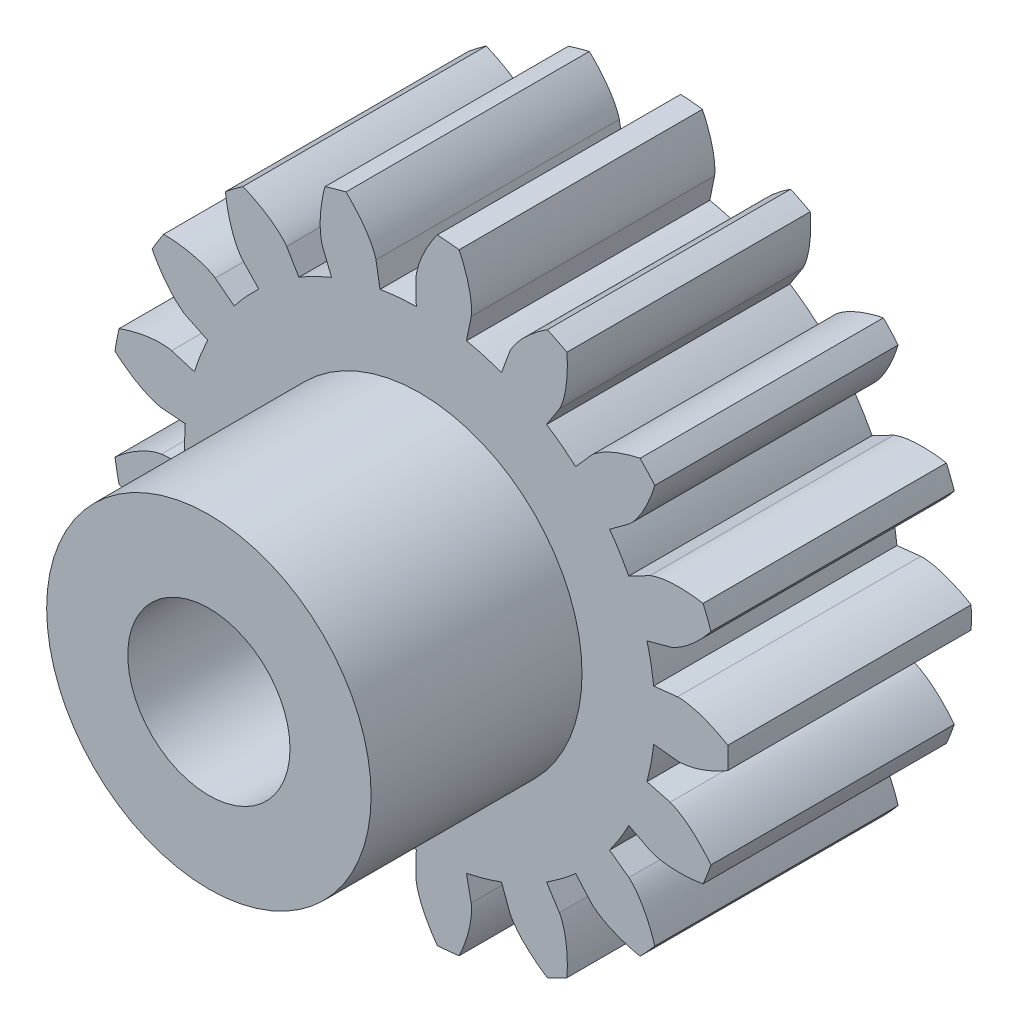
from build123d import *

# Parameters (mm, degrees)
SZKIC1_R                    = 9.5
DODANIE_WYCI_GNI_CIE1_DEPTH = 7.5
SZKIC2_R                    = 5
DODANIE_WYCI_GNI_CIE2_DEPTH = 6.5
SZKIC3_R                    = 2.5
WYTNIJ_WYCI_GNI_CIE1_DEPTH  = 20.403607912
WYTNIJ_WYCI_GNI_CIE3_DEPTH  = 10


with BuildPart() as part:
    # Szkic1 → Dodanie-wyciągnięcie1 (new body)
    with BuildSketch(Plane.XY):
        Circle(SZKIC1_R)
    extrude(amount=DODANIE_WYCI_GNI_CIE1_DEPTH)

    # Szkic2 → Dodanie-wyciągnięcie2 (add)
    with BuildSketch(Plane.XY.offset(7.5)):
        with Locations(Location((0, 0, 0), (0, 0, 180))):
            Circle(SZKIC2_R)
    extrude(amount=DODANIE_WYCI_GNI_CIE2_DEPTH)

    # Szkic3 → Wytnij-wyciągnięcie1 (cut, through all)
    with BuildSketch(Plane.XY.offset(14)):
        Circle(SZKIC3_R)
    extrude(amount=-WYTNIJ_WYCI_GNI_CIE1_DEPTH, mode=Mode.SUBTRACT)

    # Szkic5 → Wytnij-wyciągnięcie3 (cut)
    with BuildSketch(Plane(origin=(0, 0, 0), x_dir=(-1, 0, 0), z_dir=(0, 0, -1))):
        with BuildLine():
            add(Edge.make_bspline(
                [(-6.445103932, 4.717943494), (-6.447753047, 4.719948021), (-6.455084128, 4.725699992), (-6.468549193, 4.737084044), (-6.48993824, 4.75636624), (-6.516319022, 4.781958668), (-6.549384668, 4.816185791), (-6.586982164, 4.857956124), (-6.626847309, 4.905345175), (-6.668616331, 4.95846696), (-6.708843778, 5.01281802), (-6.747606045, 5.068267615), (-6.784971395, 5.124596973), (-6.828734543, 5.194088915), (-6.879111818, 5.279147161), (-6.934878107, 5.380999911), (-6.994400572, 5.499321176), (-7.051006237, 5.622778311), (-7.1033458, 5.746575884), (-7.152299389, 5.874186724), (-7.192770252, 5.987908476), (-7.220727721, 6.074514444), (-7.237000382, 6.126888761), (-7.243163934, 6.147078674)],
                knots=[0, 0, 0, 0, 0, 0.005376749, 0.015083688, 0.02853182, 0.046610139, 0.064854849, 0.092110525, 0.119476176, 0.146842496, 0.174208854, 0.201574956, 0.228941013, 0.256307345, 0.307035032, 0.361767352, 0.416499661, 0.471231937, 0.525964282, 0.580696615, 0.635428982, 0.670002826, 0.670002826, 0.670002826, 0.670002826, 0.670002826], degree=4))
            ThreePointArc((-7.243163934, 6.147078674), (-8.077062789, 5.001105547), (-8.731195161, 3.743825726))
            add(Edge.make_bspline(
                [(-7.096159856, 3.666452073), (-7.099135047, 3.667929969), (-7.107551744, 3.67192861), (-7.123744226, 3.678907732), (-7.150538858, 3.689459608), (-7.185207187, 3.701667189), (-7.230584678, 3.716010001), (-7.284734592, 3.731047259), (-7.344924955, 3.745609956), (-7.411095682, 3.759321634), (-7.477679672, 3.771105415), (-7.544593944, 3.781087963), (-7.611673087, 3.789427897), (-7.693386636, 3.797627837), (-7.791982739, 3.804810001), (-7.908014756, 3.809330259), (-8.040463055, 3.809872258), (-8.176208666, 3.805513991), (-8.31035746, 3.79718512), (-8.446410491, 3.78412553), (-8.566249445, 3.769663414), (-8.656237645, 3.756086312), (-8.71037456, 3.747307759), (-8.731195161, 3.743825726)],
                knots=[0, 0, 0, 0, 0, 0.005376749, 0.015083688, 0.02853182, 0.046610139, 0.064854849, 0.092110525, 0.119476176, 0.146842496, 0.174208854, 0.201574956, 0.228941013, 0.256307345, 0.307035032, 0.361767352, 0.416499661, 0.471231937, 0.525964282, 0.580696615, 0.635428982, 0.670002826, 0.670002826, 0.670002826, 0.670002826, 0.670002826], degree=4))
            Line((-7.096159856, 3.666452073), (-6.441049767, 3.327969035))
            add(Edge.make_bspline(
                [(-6.441049767, 3.327969035), (-6.180635855, 3.830846497), (-5.850098648, 4.282387863)],
                knots=[0, 0, 0, 0.49973366, 0.49973366, 0.49973366], degree=2))
            Line((-5.850098648, 4.282387863), (-6.445103932, 4.717943494))
        make_face()
        with BuildLine():
            add(Edge.make_bspline(
                [(-4.305562663, 6.727591371), (-4.307308771, 6.730417508), (-4.312066949, 6.738429352), (-4.320510354, 6.753908808), (-4.333489513, 6.779615535), (-4.348843809, 6.813009601), (-4.367312343, 6.856870132), (-4.387281779, 6.909401589), (-4.40733602, 6.967991515), (-4.427094671, 7.032614815), (-4.44497178, 7.097827499), (-4.461085814, 7.163535253), (-4.475579454, 7.229558736), (-4.491283989, 7.310167115), (-4.507532816, 7.407679938), (-4.522739876, 7.522799906), (-4.53550035, 7.654633194), (-4.5436857, 7.790201869), (-4.547770047, 7.924546898), (-4.547319557, 8.061224539), (-4.543976478, 8.181886676), (-4.538760357, 8.272743739), (-4.535014376, 8.327459698), (-4.533468279, 8.348512763)],
                knots=[0, 0, 0, 0, 0, 0.005376749, 0.015083688, 0.02853182, 0.046610139, 0.064854849, 0.092110525, 0.119476176, 0.146842496, 0.174208854, 0.201574956, 0.228941013, 0.256307345, 0.307035032, 0.361767352, 0.416499661, 0.471231937, 0.525964282, 0.580696615, 0.635428982, 0.670002826, 0.670002826, 0.670002826, 0.670002826, 0.670002826], degree=4))
            ThreePointArc((-4.533468279, 8.348512763), (-5.725029046, 7.581163659), (-6.789171173, 6.645085009))
            add(Edge.make_bspline(
                [(-5.292496745, 5.982293348), (-5.294737151, 5.984746208), (-5.301141011, 5.991515291), (-5.313718901, 6.003872529), (-5.334892375, 6.023391197), (-5.362809741, 6.047298073), (-5.39994177, 6.077064586), (-5.445002977, 6.110647617), (-5.495868167, 6.145970195), (-5.552617303, 6.182659577), (-5.610448231, 6.217700538), (-5.669237819, 6.25118121), (-5.728774525, 6.283189748), (-5.802007981, 6.320354302), (-5.891351612, 6.362668491), (-5.99791534, 6.408799106), (-6.121223908, 6.457150349), (-6.249377308, 6.502123357), (-6.377476068, 6.54281705), (-6.50905941, 6.579787369), (-6.626030225, 6.60959267), (-6.714846337, 6.629439887), (-6.768498686, 6.64081064), (-6.789171173, 6.645085009)],
                knots=[0, 0, 0, 0, 0, 0.005376749, 0.015083688, 0.02853182, 0.046610139, 0.064854849, 0.092110525, 0.119476176, 0.146842496, 0.174208854, 0.201574956, 0.228941013, 0.256307345, 0.307035032, 0.361767352, 0.416499661, 0.471231937, 0.525964282, 0.580696615, 0.635428982, 0.670002826, 0.670002826, 0.670002826, 0.670002826, 0.670002826], degree=4))
            Line((-5.292496745, 5.982293348), (-4.803898957, 5.430014255))
            add(Edge.make_bspline(
                [(-4.803898957, 5.430014255), (-4.379409923, 5.804861168), (-3.908077601, 6.106507141)],
                knots=[0, 0, 0, 0.49973366, 0.49973366, 0.49973366], degree=2))
            Line((-3.908077601, 6.106507141), (-4.305562663, 6.727591371))
        make_face()
        with BuildLine():
            add(Edge.make_bspline(
                [(-1.584531299, 7.828640755), (-1.585138578, 7.831906815), (-1.586681234, 7.84109649), (-1.588962651, 7.858580762), (-1.591779016, 7.887240185), (-1.594033142, 7.923925835), (-1.595410286, 7.971496166), (-1.595054679, 8.027694083), (-1.59258958, 8.089571989), (-1.587669344, 8.15696907), (-1.580781714, 8.224236044), (-1.572071224, 8.29132776), (-1.561735708, 8.358128531), (-1.547260646, 8.438966738), (-1.527186531, 8.535764491), (-1.499780563, 8.648604088), (-1.464055674, 8.776144584), (-1.422715231, 8.905515497), (-1.37799275, 9.032263943), (-1.328199022, 9.159549311), (-1.281493501, 9.270855744), (-1.243808256, 9.353693151), (-1.220549549, 9.403361059), (-1.211502613, 9.422433944)],
                knots=[0, 0, 0, 0, 0, 0.005376749, 0.015083688, 0.02853182, 0.046610139, 0.064854849, 0.092110525, 0.119476176, 0.146842496, 0.174208854, 0.201574956, 0.228941013, 0.256307345, 0.307035032, 0.361767352, 0.416499661, 0.471231937, 0.525964282, 0.580696615, 0.635428982, 0.670002826, 0.670002826, 0.670002826, 0.670002826, 0.670002826], degree=4))
            ThreePointArc((-1.211502613, 9.422433944), (-2.599798406, 9.13734361), (-3.930231999, 8.64888874))
            add(Edge.make_bspline(
                [(-2.774052623, 7.490192758), (-2.775255663, 7.49328931), (-2.77878181, 7.501914633), (-2.786046394, 7.517981071), (-2.798739114, 7.543830429), (-2.816135124, 7.576207842), (-2.840006805, 7.617377925), (-2.869893539, 7.664971154), (-2.904563928, 7.716283103), (-2.944227188, 7.770995086), (-2.985494668, 7.824560749), (-3.028219712, 7.877017795), (-3.07217322, 7.928372006), (-3.127035998, 7.989481897), (-3.195060805, 8.061213346), (-3.277764222, 8.142724121), (-3.375279553, 8.232354506), (-3.478532916, 8.320584934), (-3.583281194, 8.404805282), (-3.692623787, 8.486812463), (-3.790928907, 8.556859811), (-3.866577823, 8.60745087), (-3.912499559, 8.637435245), (-3.930231999, 8.64888874)],
                knots=[0, 0, 0, 0, 0, 0.005376749, 0.015083688, 0.02853182, 0.046610139, 0.064854849, 0.092110525, 0.119476176, 0.146842496, 0.174208854, 0.201574956, 0.228941013, 0.256307345, 0.307035032, 0.361767352, 0.416499661, 0.471231937, 0.525964282, 0.580696615, 0.635428982, 0.670002826, 0.670002826, 0.670002826, 0.670002826, 0.670002826], degree=4))
            Line((-2.774052623, 7.490192758), (-2.517954973, 6.798705962))
            add(Edge.make_bspline(
                [(-2.517954973, 6.798705962), (-1.986720414, 6.994897172), (-1.438249019, 7.105908792)],
                knots=[0, 0, 0, 0.49973366, 0.49973366, 0.49973366], degree=2))
            Line((-1.438249019, 7.105908792), (-1.584531299, 7.828640755))
        make_face()
        with BuildLine():
            add(Edge.make_bspline(
                [(1.350499797, 7.872388825), (1.351113364, 7.875653709), (1.352994573, 7.884780098), (1.357183263, 7.901907839), (1.364910058, 7.929649343), (1.376060534, 7.964671977), (1.391960771, 8.009527472), (1.412593394, 8.061802009), (1.437244908, 8.118610941), (1.466179525, 8.179679453), (1.496901683, 8.239915939), (1.529260296, 8.29933051), (1.5630291, 8.357886754), (1.605728822, 8.428037142), (1.659414758, 8.511046752), (1.725732426, 8.606366364), (1.805117834, 8.712389016), (1.890400813, 8.81808991), (1.977890105, 8.920123692), (2.070302152, 9.020826194), (2.154062274, 9.107744371), (2.219127041, 9.171374473), (2.258757258, 9.209286404), (2.274083195, 9.223803208)],
                knots=[0, 0, 0, 0, 0, 0.005376749, 0.015083688, 0.02853182, 0.046610139, 0.064854849, 0.092110525, 0.119476176, 0.146842496, 0.174208854, 0.201574956, 0.228941013, 0.256307345, 0.307035032, 0.361767352, 0.416499661, 0.471231937, 0.525964282, 0.580696615, 0.635428982, 0.670002826, 0.670002826, 0.670002826, 0.670002826, 0.670002826], degree=4))
            ThreePointArc((2.274083195, 9.223803208), (0.876549415, 9.459474675), (-0.540493215, 9.484612121))
            add(Edge.make_bspline(
                [(0.119042679, 7.986500131), (0.11903948, 7.989822168), (0.118867272, 7.999138833), (0.117897116, 8.016744612), (0.115399372, 8.045433559), (0.110874147, 8.081908761), (0.103486817, 8.128922166), (0.092810925, 8.184097864), (0.079017763, 8.244469221), (0.061797123, 8.309814647), (0.042666494, 8.374670674), (0.021776246, 8.439019478), (-0.000657898, 8.502783693), (-0.029740476, 8.579585691), (-0.067259331, 8.671046669), (-0.114932882, 8.776929123), (-0.173484991, 8.895733569), (-0.237893378, 9.01530541), (-0.30514434, 9.131677988), (-0.37747886, 9.247646508), (-0.443841634, 9.34847562), (-0.496106549, 9.422977918), (-0.528095687, 9.467526359), (-0.540493215, 9.484612121)],
                knots=[0, 0, 0, 0, 0, 0.005376749, 0.015083688, 0.02853182, 0.046610139, 0.064854849, 0.092110525, 0.119476176, 0.146842496, 0.174208854, 0.201574956, 0.228941013, 0.256307345, 0.307035032, 0.361767352, 0.416499661, 0.471231937, 0.525964282, 0.580696615, 0.635428982, 0.670002826, 0.670002826, 0.670002826, 0.670002826, 0.670002826], degree=4))
            Line((0.119042679, 7.986500131), (0.108052782, 7.249194755))
            add(Edge.make_bspline(
                [(0.108052782, 7.249194755), (0.674286695, 7.240233553), (1.225823062, 7.145618085)],
                knots=[0, 0, 0, 0.49973366, 0.49973366, 0.49973366], degree=2))
            Line((1.225823062, 7.145618085), (1.350499797, 7.872388825))
        make_face()
        with BuildLine():
            add(Edge.make_bspline(
                [(4.103138413, 6.852927161), (4.104889959, 6.85574993), (4.109940966, 6.863580462), (4.120034057, 6.878038476), (4.137260466, 6.901115417), (4.160309609, 6.929745035), (4.191339813, 6.96582771), (4.229462901, 7.007118901), (4.272971507, 7.051186499), (4.322012725, 7.097678801), (4.372420212, 7.142749528), (4.424056739, 7.186462686), (4.476698166, 7.228866059), (4.541855714, 7.278854429), (4.621902888, 7.336864987), (4.718175688, 7.401791174), (4.830500175, 7.471977036), (4.948207752, 7.539732418), (5.066647941, 7.603271309), (5.189197548, 7.663790513), (5.298700003, 7.714581654), (5.382356935, 7.750410852), (5.433006381, 7.771446589), (5.452541466, 7.779446738)],
                knots=[0, 0, 0, 0, 0, 0.005376749, 0.015083688, 0.02853182, 0.046610139, 0.064854849, 0.092110525, 0.119476176, 0.146842496, 0.174208854, 0.201574956, 0.228941013, 0.256307345, 0.307035032, 0.361767352, 0.416499661, 0.471231937, 0.525964282, 0.580696615, 0.635428982, 0.670002826, 0.670002826, 0.670002826, 0.670002826, 0.670002826], degree=4))
            ThreePointArc((5.452541466, 7.779446738), (4.23451438, 8.504051268), (2.922242172, 9.039386079))
            add(Edge.make_bspline(
                [(2.996060606, 7.404186407), (2.997257682, 7.407285269), (3.00046267, 7.41603501), (3.005917968, 7.43280237), (3.013952534, 7.460456306), (3.02290925, 7.496103119), (3.033003971, 7.542610425), (3.042980759, 7.597916808), (3.051927668, 7.659194086), (3.05947539, 7.726347695), (3.065065308, 7.793734919), (3.068831202, 7.861284819), (3.070946277, 7.928847327), (3.071571662, 8.010968895), (3.069625888, 8.109807091), (3.063420779, 8.225761213), (3.05173968, 8.35769452), (3.034874979, 8.492458934), (3.014203949, 8.625266982), (2.988646679, 8.759534648), (2.963188911, 8.877527994), (2.941366664, 8.965879583), (2.927630434, 9.018975577), (2.922242172, 9.039386079)],
                knots=[0, 0, 0, 0, 0, 0.005376749, 0.015083688, 0.02853182, 0.046610139, 0.064854849, 0.092110525, 0.119476176, 0.146842496, 0.174208854, 0.201574956, 0.228941013, 0.256307345, 0.307035032, 0.361767352, 0.416499661, 0.471231937, 0.525964282, 0.580696615, 0.635428982, 0.670002826, 0.670002826, 0.670002826, 0.670002826, 0.670002826], degree=4))
            Line((2.996060606, 7.404186407), (2.719467411, 6.720639627))
            add(Edge.make_bspline(
                [(2.719467411, 6.720639627), (3.24422765, 6.507736273), (3.724340947, 6.220272061)],
                knots=[0, 0, 0, 0.49973366, 0.49973366, 0.49973366], degree=2))
            Line((3.724340947, 6.220272061), (4.103138413, 6.852927161))
        make_face()
        with BuildLine():
            add(Edge.make_bspline(
                [(6.301625449, 4.907939711), (6.304278419, 4.909939133), (6.311817057, 4.915416253), (6.326451421, 4.925251904), (6.350850922, 4.940547614), (6.382685819, 4.958917627), (6.424655188, 4.981354317), (6.475120007, 5.006085558), (6.531609627, 5.031460248), (6.594134157, 5.057097297), (6.657419164, 5.080915213), (6.721359805, 5.103023255), (6.785764339, 5.123546945), (6.864579825, 5.146622091), (6.960177423, 5.171798951), (7.073403179, 5.197563071), (7.203496702, 5.222433153), (7.337731815, 5.243092284), (7.471126897, 5.259555004), (7.60726306, 5.271717457), (7.727718935, 5.279521936), (7.818669701, 5.282711298), (7.873497886, 5.284029849), (7.894603799, 5.284432879)],
                knots=[0, 0, 0, 0, 0, 0.005376749, 0.015083688, 0.02853182, 0.046610139, 0.064854849, 0.092110525, 0.119476176, 0.146842496, 0.174208854, 0.201574956, 0.228941013, 0.256307345, 0.307035032, 0.361767352, 0.416499661, 0.471231937, 0.525964282, 0.580696615, 0.635428982, 0.670002826, 0.670002826, 0.670002826, 0.670002826, 0.670002826], degree=4))
            ThreePointArc((7.894603799, 5.284432879), (7.020584714, 6.400108615), (5.990312562, 7.373340858))
            add(Edge.make_bspline(
                [(5.468443947, 5.82189628), (5.470679625, 5.82435345), (5.476828959, 5.831354565), (5.487972941, 5.845018982), (5.505454705, 5.867903088), (5.526683708, 5.897907213), (5.552897132, 5.93762735), (5.58217918, 5.985594985), (5.61265783, 6.039502349), (5.643954552, 6.099394672), (5.673510069, 6.160212076), (5.7014235, 6.221840085), (5.727802141, 6.284076193), (5.758051027, 6.360426361), (5.791941121, 6.453293128), (5.82804249, 6.56365867), (5.864809997, 6.690902515), (5.897766653, 6.822658822), (5.926467292, 6.953965875), (5.951138923, 7.088399096), (5.970024375, 7.207621021), (5.98159201, 7.297889529), (5.987963842, 7.352362167), (5.990312562, 7.373340858)],
                knots=[0, 0, 0, 0, 0, 0.005376749, 0.015083688, 0.02853182, 0.046610139, 0.064854849, 0.092110525, 0.119476176, 0.146842496, 0.174208854, 0.201574956, 0.228941013, 0.256307345, 0.307035032, 0.361767352, 0.416499661, 0.471231937, 0.525964282, 0.580696615, 0.635428982, 0.670002826, 0.670002826, 0.670002826, 0.670002826, 0.670002826], degree=4))
            Line((5.468443947, 5.82189628), (4.963602896, 5.284424878))
            add(Edge.make_bspline(
                [(4.963602896, 5.284424878), (5.376017684, 4.896333149), (5.719865949, 4.454843827)],
                knots=[0, 0, 0, 0.49973366, 0.49973366, 0.49973366], degree=2))
            Line((5.719865949, 4.454843827), (6.301625449, 4.907939711))
        make_face()
        with BuildLine():
            add(Edge.make_bspline(
                [(7.64904305, 2.300107807), (7.652239145, 2.301013849), (7.66124728, 2.303397841), (7.678446465, 2.307282771), (7.70672377, 2.31273148), (7.743044942, 2.318360915), (7.790285279, 2.324121421), (7.846276277, 2.32895262), (7.908117674, 2.33220741), (7.975681232, 2.333526781), (8.043296767, 2.332875145), (8.110905985, 2.330392256), (8.178375437, 2.326264426), (8.260204393, 2.319309921), (8.358441429, 2.308252809), (8.473328375, 2.291375274), (8.603621083, 2.267570734), (8.736254537, 2.238343484), (8.866588767, 2.205506652), (8.997925544, 2.167669747), (9.113066604, 2.131433526), (9.199027798, 2.101552312), (9.250629874, 2.082975598), (9.270456143, 2.075727078)],
                knots=[0, 0, 0, 0, 0, 0.005376749, 0.015083688, 0.02853182, 0.046610139, 0.064854849, 0.092110525, 0.119476176, 0.146842496, 0.174208854, 0.201574956, 0.228941013, 0.256307345, 0.307035032, 0.361767352, 0.416499661, 0.471231937, 0.525964282, 0.580696615, 0.635428982, 0.670002826, 0.670002826, 0.670002826, 0.670002826, 0.670002826], degree=4))
            ThreePointArc((9.270456143, 2.075727078), (8.858486179, 3.431795829), (8.249358046, 4.711485098))
            add(Edge.make_bspline(
                [(7.202283632, 3.453326801), (7.205255971, 3.454810423), (7.213519148, 3.459117373), (7.228846759, 3.467833391), (7.253414711, 3.482857044), (7.284048907, 3.503166256), (7.322840765, 3.530734801), (7.36747337, 3.564885393), (7.415367451, 3.604142354), (7.466186378, 3.648684602), (7.515715857, 3.694718458), (7.56400696, 3.74210137), (7.611086586, 3.790605749), (7.666873694, 3.850873001), (7.732022612, 3.925226169), (7.805554768, 4.015097653), (7.885805226, 4.12046705), (7.96413226, 4.231420829), (8.038328387, 4.343493144), (8.109896879, 4.459935968), (8.170574965, 4.56428489), (8.21397021, 4.644279055), (8.239589553, 4.692771506), (8.249358046, 4.711485098)],
                knots=[0, 0, 0, 0, 0, 0.005376749, 0.015083688, 0.02853182, 0.046610139, 0.064854849, 0.092110525, 0.119476176, 0.146842496, 0.174208854, 0.201574956, 0.228941013, 0.256307345, 0.307035032, 0.361767352, 0.416499661, 0.471231937, 0.525964282, 0.580696615, 0.635428982, 0.670002826, 0.670002826, 0.670002826, 0.670002826, 0.670002826], degree=4))
            Line((7.202283632, 3.453326801), (6.537376306, 3.134519266))
            add(Edge.make_bspline(
                [(6.537376306, 3.134519266), (6.78174674, 2.623653102), (6.94289136, 2.087764249)],
                knots=[0, 0, 0, 0.49973366, 0.49973366, 0.49973366], degree=2))
            Line((6.94289136, 2.087764249), (7.64904305, 2.300107807))
        make_face()
        with BuildLine():
            add(Edge.make_bspline(
                [(7.963415002, 0.618366401), (7.966722573, 0.618676105), (7.975983606, 0.619707212), (7.993424766, 0.622297686), (8.021760868, 0.627431857), (8.057662939, 0.635303285), (8.103794176, 0.646996952), (8.157749457, 0.662718274), (8.216590608, 0.682022962), (8.280068362, 0.705199458), (8.342882573, 0.730232638), (8.405029368, 0.75697113), (8.466451614, 0.785192994), (8.540242586, 0.821237905), (8.627851604, 0.867035666), (8.728883622, 0.92427545), (8.841778762, 0.993539678), (8.954897675, 1.068706007), (9.064568692, 1.146407595), (9.173368323, 1.229133774), (9.267644132, 1.304516793), (9.337006218, 1.36343296), (9.378413038, 1.399396049), (9.394282015, 1.413317167)],
                knots=[0, 0, 0, 0, 0, 0.005376749, 0.015083688, 0.02853182, 0.046610139, 0.064854849, 0.092110525, 0.119476176, 0.146842496, 0.174208854, 0.201574956, 0.228941013, 0.256307345, 0.307035032, 0.361767352, 0.416499661, 0.471231937, 0.525964282, 0.580696615, 0.635428982, 0.670002826, 0.670002826, 0.670002826, 0.670002826, 0.670002826], degree=4))
            Line((7.963415002, 0.618366401), (7.228240821, 0.561279459))
            add(Edge.make_bspline(
                [(7.228240821, 0.561279459), (7.27156332, -0.003365835), (7.228240821, -0.561279459)],
                knots=[0, 0, 0, 0.49973366, 0.49973366, 0.49973366], degree=2))
            Line((7.228240821, -0.561279459), (7.963415002, -0.618366401))
            add(Edge.make_bspline(
                [(7.963415002, -0.618366401), (7.966722573, -0.618676105), (7.975983606, -0.619707212), (7.993424766, -0.622297686), (8.021760868, -0.627431857), (8.057662939, -0.635303285), (8.103794176, -0.646996952), (8.157749457, -0.662718274), (8.216590608, -0.682022962), (8.280068362, -0.705199458), (8.342882573, -0.730232638), (8.405029368, -0.75697113), (8.466451614, -0.785192994), (8.540242586, -0.821237905), (8.627851604, -0.867035666), (8.728883622, -0.92427545), (8.841778762, -0.993539678), (8.954897675, -1.068706007), (9.064568692, -1.146407595), (9.173368323, -1.229133774), (9.267644132, -1.304516793), (9.337006218, -1.36343296), (9.378413038, -1.399396049), (9.394282015, -1.413317167)],
                knots=[0, 0, 0, 0, 0, 0.005376749, 0.015083688, 0.02853182, 0.046610139, 0.064854849, 0.092110525, 0.119476176, 0.146842496, 0.174208854, 0.201574956, 0.228941013, 0.256307345, 0.307035032, 0.361767352, 0.416499661, 0.471231937, 0.525964282, 0.580696615, 0.635428982, 0.670002826, 0.670002826, 0.670002826, 0.670002826, 0.670002826], degree=4))
            ThreePointArc((9.394282015, -1.413317167), (9.473533637, -0.708632787), (9.5, 0))
            ThreePointArc((9.5, 0), (9.473533637, 0.708632787), (9.394282015, 1.413317167))
        make_face()
        with BuildLine():
            ThreePointArc((8.249358046, -4.711485098), (8.858486179, -3.431795829), (9.270456143, -2.075727078))
            add(Edge.make_bspline(
                [(7.64904305, -2.300107807), (7.652239145, -2.301013849), (7.66124728, -2.303397841), (7.678446465, -2.307282771), (7.70672377, -2.31273148), (7.743044942, -2.318360915), (7.790285279, -2.324121421), (7.846276277, -2.32895262), (7.908117674, -2.33220741), (7.975681232, -2.333526781), (8.043296767, -2.332875145), (8.110905985, -2.330392256), (8.178375437, -2.326264426), (8.260204393, -2.319309921), (8.358441429, -2.308252809), (8.473328375, -2.291375274), (8.603621083, -2.267570734), (8.736254537, -2.238343484), (8.866588767, -2.205506652), (8.997925544, -2.167669747), (9.113066604, -2.131433526), (9.199027798, -2.101552312), (9.250629874, -2.082975598), (9.270456143, -2.075727078)],
                knots=[0, 0, 0, 0, 0, 0.005376749, 0.015083688, 0.02853182, 0.046610139, 0.064854849, 0.092110525, 0.119476176, 0.146842496, 0.174208854, 0.201574956, 0.228941013, 0.256307345, 0.307035032, 0.361767352, 0.416499661, 0.471231937, 0.525964282, 0.580696615, 0.635428982, 0.670002826, 0.670002826, 0.670002826, 0.670002826, 0.670002826], degree=4))
            Line((7.64904305, -2.300107807), (6.94289136, -2.087764249))
            add(Edge.make_bspline(
                [(6.94289136, -2.087764249), (6.779314981, -2.629930197), (6.537376306, -3.134519266)],
                knots=[0, 0, 0, 0.49973366, 0.49973366, 0.49973366], degree=2))
            Line((6.537376306, -3.134519266), (7.202283632, -3.453326801))
            add(Edge.make_bspline(
                [(7.202283632, -3.453326801), (7.205255971, -3.454810423), (7.213519148, -3.459117373), (7.228846759, -3.467833391), (7.253414711, -3.482857044), (7.284048907, -3.503166256), (7.322840765, -3.530734801), (7.36747337, -3.564885393), (7.415367451, -3.604142354), (7.466186378, -3.648684602), (7.515715857, -3.694718458), (7.56400696, -3.74210137), (7.611086586, -3.790605749), (7.666873694, -3.850873001), (7.732022612, -3.925226169), (7.805554768, -4.015097653), (7.885805226, -4.12046705), (7.96413226, -4.231420829), (8.038328387, -4.343493144), (8.109896879, -4.459935968), (8.170574965, -4.56428489), (8.21397021, -4.644279055), (8.239589553, -4.692771506), (8.249358046, -4.711485098)],
                knots=[0, 0, 0, 0, 0, 0.005376749, 0.015083688, 0.02853182, 0.046610139, 0.064854849, 0.092110525, 0.119476176, 0.146842496, 0.174208854, 0.201574956, 0.228941013, 0.256307345, 0.307035032, 0.361767352, 0.416499661, 0.471231937, 0.525964282, 0.580696615, 0.635428982, 0.670002826, 0.670002826, 0.670002826, 0.670002826, 0.670002826], degree=4))
        make_face()
        with BuildLine():
            ThreePointArc((5.990312562, -7.373340858), (7.020584714, -6.400108615), (7.894603799, -5.284432879))
            add(Edge.make_bspline(
                [(6.301625449, -4.907939711), (6.304278419, -4.909939133), (6.311817057, -4.915416253), (6.326451421, -4.925251904), (6.350850922, -4.940547614), (6.382685819, -4.958917627), (6.424655188, -4.981354317), (6.475120007, -5.006085558), (6.531609627, -5.031460248), (6.594134157, -5.057097297), (6.657419164, -5.080915213), (6.721359805, -5.103023255), (6.785764339, -5.123546945), (6.864579825, -5.146622091), (6.960177423, -5.171798951), (7.073403179, -5.197563071), (7.203496702, -5.222433153), (7.337731815, -5.243092284), (7.471126897, -5.259555004), (7.60726306, -5.271717457), (7.727718935, -5.279521936), (7.818669701, -5.282711298), (7.873497886, -5.284029849), (7.894603799, -5.284432879)],
                knots=[0, 0, 0, 0, 0, 0.005376749, 0.015083688, 0.02853182, 0.046610139, 0.064854849, 0.092110525, 0.119476176, 0.146842496, 0.174208854, 0.201574956, 0.228941013, 0.256307345, 0.307035032, 0.361767352, 0.416499661, 0.471231937, 0.525964282, 0.580696615, 0.635428982, 0.670002826, 0.670002826, 0.670002826, 0.670002826, 0.670002826], degree=4))
            Line((6.301625449, -4.907939711), (5.719865949, -4.454843827))
            add(Edge.make_bspline(
                [(5.719865949, -4.454843827), (5.371482587, -4.901307914), (4.963602896, -5.284424878)],
                knots=[0, 0, 0, 0.49973366, 0.49973366, 0.49973366], degree=2))
            Line((4.963602896, -5.284424878), (5.468443947, -5.82189628))
            add(Edge.make_bspline(
                [(5.468443947, -5.82189628), (5.470679625, -5.82435345), (5.476828959, -5.831354565), (5.487972941, -5.845018982), (5.505454705, -5.867903088), (5.526683708, -5.897907213), (5.552897132, -5.93762735), (5.58217918, -5.985594985), (5.61265783, -6.039502349), (5.643954552, -6.099394672), (5.673510069, -6.160212076), (5.7014235, -6.221840085), (5.727802141, -6.284076193), (5.758051027, -6.360426361), (5.791941121, -6.453293128), (5.82804249, -6.56365867), (5.864809997, -6.690902515), (5.897766653, -6.822658822), (5.926467292, -6.953965875), (5.951138923, -7.088399096), (5.970024375, -7.207621021), (5.98159201, -7.297889529), (5.987963842, -7.352362167), (5.990312562, -7.373340858)],
                knots=[0, 0, 0, 0, 0, 0.005376749, 0.015083688, 0.02853182, 0.046610139, 0.064854849, 0.092110525, 0.119476176, 0.146842496, 0.174208854, 0.201574956, 0.228941013, 0.256307345, 0.307035032, 0.361767352, 0.416499661, 0.471231937, 0.525964282, 0.580696615, 0.635428982, 0.670002826, 0.670002826, 0.670002826, 0.670002826, 0.670002826], degree=4))
        make_face()
        with BuildLine():
            ThreePointArc((2.922242172, -9.039386079), (4.23451438, -8.504051268), (5.452541466, -7.779446738))
            add(Edge.make_bspline(
                [(4.103138413, -6.852927161), (4.104889959, -6.85574993), (4.109940966, -6.863580462), (4.120034057, -6.878038476), (4.137260466, -6.901115417), (4.160309609, -6.929745035), (4.191339813, -6.96582771), (4.229462901, -7.007118901), (4.272971507, -7.051186499), (4.322012725, -7.097678801), (4.372420212, -7.142749528), (4.424056739, -7.186462686), (4.476698166, -7.228866059), (4.541855714, -7.278854429), (4.621902888, -7.336864987), (4.718175688, -7.401791174), (4.830500175, -7.471977036), (4.948207752, -7.539732418), (5.066647941, -7.603271309), (5.189197548, -7.663790513), (5.298700003, -7.714581654), (5.382356935, -7.750410852), (5.433006381, -7.771446589), (5.452541466, -7.779446738)],
                knots=[0, 0, 0, 0, 0, 0.005376749, 0.015083688, 0.02853182, 0.046610139, 0.064854849, 0.092110525, 0.119476176, 0.146842496, 0.174208854, 0.201574956, 0.228941013, 0.256307345, 0.307035032, 0.361767352, 0.416499661, 0.471231937, 0.525964282, 0.580696615, 0.635428982, 0.670002826, 0.670002826, 0.670002826, 0.670002826, 0.670002826], degree=4))
            Line((4.103138413, -6.852927161), (3.724340947, -6.220272061))
            add(Edge.make_bspline(
                [(3.724340947, -6.220272061), (3.238201706, -6.510736837), (2.719467411, -6.720639627)],
                knots=[0, 0, 0, 0.49973366, 0.49973366, 0.49973366], degree=2))
            Line((2.719467411, -6.720639627), (2.996060606, -7.404186407))
            add(Edge.make_bspline(
                [(2.996060606, -7.404186407), (2.997257682, -7.407285269), (3.00046267, -7.41603501), (3.005917968, -7.43280237), (3.013952534, -7.460456306), (3.02290925, -7.496103119), (3.033003971, -7.542610425), (3.042980759, -7.597916808), (3.051927668, -7.659194086), (3.05947539, -7.726347695), (3.065065308, -7.793734919), (3.068831202, -7.861284819), (3.070946277, -7.928847327), (3.071571662, -8.010968895), (3.069625888, -8.109807091), (3.063420779, -8.225761213), (3.05173968, -8.35769452), (3.034874979, -8.492458934), (3.014203949, -8.625266982), (2.988646679, -8.759534648), (2.963188911, -8.877527994), (2.941366664, -8.965879583), (2.927630434, -9.018975577), (2.922242172, -9.039386079)],
                knots=[0, 0, 0, 0, 0, 0.005376749, 0.015083688, 0.02853182, 0.046610139, 0.064854849, 0.092110525, 0.119476176, 0.146842496, 0.174208854, 0.201574956, 0.228941013, 0.256307345, 0.307035032, 0.361767352, 0.416499661, 0.471231937, 0.525964282, 0.580696615, 0.635428982, 0.670002826, 0.670002826, 0.670002826, 0.670002826, 0.670002826], degree=4))
        make_face()
        with BuildLine():
            ThreePointArc((-0.540493215, -9.484612121), (0.876549415, -9.459474675), (2.274083195, -9.223803208))
            add(Edge.make_bspline(
                [(1.350499797, -7.872388825), (1.351113364, -7.875653709), (1.352994573, -7.884780098), (1.357183263, -7.901907839), (1.364910058, -7.929649343), (1.376060534, -7.964671977), (1.391960771, -8.009527472), (1.412593394, -8.061802009), (1.437244908, -8.118610941), (1.466179525, -8.179679453), (1.496901683, -8.239915939), (1.529260296, -8.29933051), (1.5630291, -8.357886754), (1.605728822, -8.428037142), (1.659414758, -8.511046752), (1.725732426, -8.606366364), (1.805117834, -8.712389016), (1.890400813, -8.81808991), (1.977890105, -8.920123692), (2.070302152, -9.020826194), (2.154062274, -9.107744371), (2.219127041, -9.171374473), (2.258757258, -9.209286404), (2.274083195, -9.223803208)],
                knots=[0, 0, 0, 0, 0, 0.005376749, 0.015083688, 0.02853182, 0.046610139, 0.064854849, 0.092110525, 0.119476176, 0.146842496, 0.174208854, 0.201574956, 0.228941013, 0.256307345, 0.307035032, 0.361767352, 0.416499661, 0.471231937, 0.525964282, 0.580696615, 0.635428982, 0.670002826, 0.670002826, 0.670002826, 0.670002826, 0.670002826], degree=4))
            Line((1.350499797, -7.872388825), (1.225823062, -7.145618085))
            add(Edge.make_bspline(
                [(1.225823062, -7.145618085), (0.667583741, -7.240854673), (0.108052782, -7.249194755)],
                knots=[0, 0, 0, 0.49973366, 0.49973366, 0.49973366], degree=2))
            Line((0.108052782, -7.249194755), (0.119042679, -7.986500131))
            add(Edge.make_bspline(
                [(0.119042679, -7.986500131), (0.11903948, -7.989822168), (0.118867272, -7.999138833), (0.117897116, -8.016744612), (0.115399372, -8.045433559), (0.110874147, -8.081908761), (0.103486817, -8.128922166), (0.092810925, -8.184097864), (0.079017763, -8.244469221), (0.061797123, -8.309814647), (0.042666494, -8.374670674), (0.021776246, -8.439019478), (-0.000657898, -8.502783693), (-0.029740476, -8.579585691), (-0.067259331, -8.671046669), (-0.114932882, -8.776929123), (-0.173484991, -8.895733569), (-0.237893378, -9.01530541), (-0.30514434, -9.131677988), (-0.37747886, -9.247646508), (-0.443841634, -9.34847562), (-0.496106549, -9.422977918), (-0.528095687, -9.467526359), (-0.540493215, -9.484612121)],
                knots=[0, 0, 0, 0, 0, 0.005376749, 0.015083688, 0.02853182, 0.046610139, 0.064854849, 0.092110525, 0.119476176, 0.146842496, 0.174208854, 0.201574956, 0.228941013, 0.256307345, 0.307035032, 0.361767352, 0.416499661, 0.471231937, 0.525964282, 0.580696615, 0.635428982, 0.670002826, 0.670002826, 0.670002826, 0.670002826, 0.670002826], degree=4))
        make_face()
        with BuildLine():
            ThreePointArc((-3.930231999, -8.64888874), (-2.599798406, -9.13734361), (-1.211502613, -9.422433944))
            add(Edge.make_bspline(
                [(-1.584531299, -7.828640755), (-1.585138578, -7.831906815), (-1.586681234, -7.84109649), (-1.588962651, -7.858580762), (-1.591779016, -7.887240185), (-1.594033142, -7.923925835), (-1.595410286, -7.971496166), (-1.595054679, -8.027694083), (-1.59258958, -8.089571989), (-1.587669344, -8.15696907), (-1.580781714, -8.224236044), (-1.572071224, -8.29132776), (-1.561735708, -8.358128531), (-1.547260646, -8.438966738), (-1.527186531, -8.535764491), (-1.499780563, -8.648604088), (-1.464055674, -8.776144584), (-1.422715231, -8.905515497), (-1.37799275, -9.032263943), (-1.328199022, -9.159549311), (-1.281493501, -9.270855744), (-1.243808256, -9.353693151), (-1.220549549, -9.403361059), (-1.211502613, -9.422433944)],
                knots=[0, 0, 0, 0, 0, 0.005376749, 0.015083688, 0.02853182, 0.046610139, 0.064854849, 0.092110525, 0.119476176, 0.146842496, 0.174208854, 0.201574956, 0.228941013, 0.256307345, 0.307035032, 0.361767352, 0.416499661, 0.471231937, 0.525964282, 0.580696615, 0.635428982, 0.670002826, 0.670002826, 0.670002826, 0.670002826, 0.670002826], degree=4))
            Line((-1.584531299, -7.828640755), (-1.438249019, -7.105908792))
            add(Edge.make_bspline(
                [(-1.438249019, -7.105908792), (-1.993195107, -6.993054963), (-2.517954973, -6.798705962)],
                knots=[0, 0, 0, 0.49973366, 0.49973366, 0.49973366], degree=2))
            Line((-2.517954973, -6.798705962), (-2.774052623, -7.490192758))
            add(Edge.make_bspline(
                [(-2.774052623, -7.490192758), (-2.775255663, -7.49328931), (-2.77878181, -7.501914633), (-2.786046394, -7.517981071), (-2.798739114, -7.543830429), (-2.816135124, -7.576207842), (-2.840006805, -7.617377925), (-2.869893539, -7.664971154), (-2.904563928, -7.716283103), (-2.944227188, -7.770995086), (-2.985494668, -7.824560749), (-3.028219712, -7.877017795), (-3.07217322, -7.928372006), (-3.127035998, -7.989481897), (-3.195060805, -8.061213346), (-3.277764222, -8.142724121), (-3.375279553, -8.232354506), (-3.478532916, -8.320584934), (-3.583281194, -8.404805282), (-3.692623787, -8.486812463), (-3.790928907, -8.556859811), (-3.866577823, -8.60745087), (-3.912499559, -8.637435245), (-3.930231999, -8.64888874)],
                knots=[0, 0, 0, 0, 0, 0.005376749, 0.015083688, 0.02853182, 0.046610139, 0.064854849, 0.092110525, 0.119476176, 0.146842496, 0.174208854, 0.201574956, 0.228941013, 0.256307345, 0.307035032, 0.361767352, 0.416499661, 0.471231937, 0.525964282, 0.580696615, 0.635428982, 0.670002826, 0.670002826, 0.670002826, 0.670002826, 0.670002826], degree=4))
        make_face()
        with BuildLine():
            ThreePointArc((-6.789171173, -6.645085009), (-5.725029046, -7.581163659), (-4.533468279, -8.348512763))
            add(Edge.make_bspline(
                [(-4.305562663, -6.727591371), (-4.307308771, -6.730417508), (-4.312066949, -6.738429352), (-4.320510354, -6.753908808), (-4.333489513, -6.779615535), (-4.348843809, -6.813009601), (-4.367312343, -6.856870132), (-4.387281779, -6.909401589), (-4.40733602, -6.967991515), (-4.427094671, -7.032614815), (-4.44497178, -7.097827499), (-4.461085814, -7.163535253), (-4.475579454, -7.229558736), (-4.491283989, -7.310167115), (-4.507532816, -7.407679938), (-4.522739876, -7.522799906), (-4.53550035, -7.654633194), (-4.5436857, -7.790201869), (-4.547770047, -7.924546898), (-4.547319557, -8.061224539), (-4.543976478, -8.181886676), (-4.538760357, -8.272743739), (-4.535014376, -8.327459698), (-4.533468279, -8.348512763)],
                knots=[0, 0, 0, 0, 0, 0.005376749, 0.015083688, 0.02853182, 0.046610139, 0.064854849, 0.092110525, 0.119476176, 0.146842496, 0.174208854, 0.201574956, 0.228941013, 0.256307345, 0.307035032, 0.361767352, 0.416499661, 0.471231937, 0.525964282, 0.580696615, 0.635428982, 0.670002826, 0.670002826, 0.670002826, 0.670002826, 0.670002826], degree=4))
            Line((-4.305562663, -6.727591371), (-3.908077601, -6.106507141))
            add(Edge.make_bspline(
                [(-3.908077601, -6.106507141), (-4.384781912, -5.80080443), (-4.803898957, -5.430014255)],
                knots=[0, 0, 0, 0.49973366, 0.49973366, 0.49973366], degree=2))
            Line((-4.803898957, -5.430014255), (-5.292496745, -5.982293348))
            add(Edge.make_bspline(
                [(-5.292496745, -5.982293348), (-5.294737151, -5.984746208), (-5.301141011, -5.991515291), (-5.313718901, -6.003872529), (-5.334892375, -6.023391197), (-5.362809741, -6.047298073), (-5.39994177, -6.077064586), (-5.445002977, -6.110647617), (-5.495868167, -6.145970195), (-5.552617303, -6.182659577), (-5.610448231, -6.217700538), (-5.669237819, -6.25118121), (-5.728774525, -6.283189748), (-5.802007981, -6.320354302), (-5.891351612, -6.362668491), (-5.99791534, -6.408799106), (-6.121223908, -6.457150349), (-6.249377308, -6.502123357), (-6.377476068, -6.54281705), (-6.50905941, -6.579787369), (-6.626030225, -6.60959267), (-6.714846337, -6.629439887), (-6.768498686, -6.64081064), (-6.789171173, -6.645085009)],
                knots=[0, 0, 0, 0, 0, 0.005376749, 0.015083688, 0.02853182, 0.046610139, 0.064854849, 0.092110525, 0.119476176, 0.146842496, 0.174208854, 0.201574956, 0.228941013, 0.256307345, 0.307035032, 0.361767352, 0.416499661, 0.471231937, 0.525964282, 0.580696615, 0.635428982, 0.670002826, 0.670002826, 0.670002826, 0.670002826, 0.670002826], degree=4))
        make_face()
        with BuildLine():
            ThreePointArc((-8.731195161, -3.743825726), (-8.077062789, -5.001105547), (-7.243163934, -6.147078674))
            add(Edge.make_bspline(
                [(-6.445103932, -4.717943494), (-6.447753047, -4.719948021), (-6.455084128, -4.725699992), (-6.468549193, -4.737084044), (-6.48993824, -4.75636624), (-6.516319022, -4.781958668), (-6.549384668, -4.816185791), (-6.586982164, -4.857956124), (-6.626847309, -4.905345175), (-6.668616331, -4.95846696), (-6.708843778, -5.01281802), (-6.747606045, -5.068267615), (-6.784971395, -5.124596973), (-6.828734543, -5.194088915), (-6.879111818, -5.279147161), (-6.934878107, -5.380999911), (-6.994400572, -5.499321176), (-7.051006237, -5.622778311), (-7.1033458, -5.746575884), (-7.152299389, -5.874186724), (-7.192770252, -5.987908476), (-7.220727721, -6.074514444), (-7.237000382, -6.126888761), (-7.243163934, -6.147078674)],
                knots=[0, 0, 0, 0, 0, 0.005376749, 0.015083688, 0.02853182, 0.046610139, 0.064854849, 0.092110525, 0.119476176, 0.146842496, 0.174208854, 0.201574956, 0.228941013, 0.256307345, 0.307035032, 0.361767352, 0.416499661, 0.471231937, 0.525964282, 0.580696615, 0.635428982, 0.670002826, 0.670002826, 0.670002826, 0.670002826, 0.670002826], degree=4))
            Line((-6.445103932, -4.717943494), (-5.850098648, -4.282387863))
            add(Edge.make_bspline(
                [(-5.850098648, -4.282387863), (-6.184179622, -3.825123116), (-6.441049767, -3.327969035)],
                knots=[0, 0, 0, 0.49973366, 0.49973366, 0.49973366], degree=2))
            Line((-6.441049767, -3.327969035), (-7.096159856, -3.666452073))
            add(Edge.make_bspline(
                [(-7.096159856, -3.666452073), (-7.099135047, -3.667929969), (-7.107551744, -3.67192861), (-7.123744226, -3.678907732), (-7.150538858, -3.689459608), (-7.185207187, -3.701667189), (-7.230584678, -3.716010001), (-7.284734592, -3.731047259), (-7.344924955, -3.745609956), (-7.411095682, -3.759321634), (-7.477679672, -3.771105415), (-7.544593944, -3.781087963), (-7.611673087, -3.789427897), (-7.693386636, -3.797627837), (-7.791982739, -3.804810001), (-7.908014756, -3.809330259), (-8.040463055, -3.809872258), (-8.176208666, -3.805513991), (-8.31035746, -3.79718512), (-8.446410491, -3.78412553), (-8.566249445, -3.769663414), (-8.656237645, -3.756086312), (-8.71037456, -3.747307759), (-8.731195161, -3.743825726)],
                knots=[0, 0, 0, 0, 0, 0.005376749, 0.015083688, 0.02853182, 0.046610139, 0.064854849, 0.092110525, 0.119476176, 0.146842496, 0.174208854, 0.201574956, 0.228941013, 0.256307345, 0.307035032, 0.361767352, 0.416499661, 0.471231937, 0.525964282, 0.580696615, 0.635428982, 0.670002826, 0.670002826, 0.670002826, 0.670002826, 0.670002826], degree=4))
        make_face()
        with BuildLine():
            ThreePointArc((-9.49402286, -0.336942034), (-9.338244447, -1.745620419), (-8.974630164, -3.115447547))
            add(Edge.make_bspline(
                [(-7.714198201, -2.071111205), (-7.717392545, -2.0720234), (-7.726306426, -2.074738661), (-7.74297462, -2.080489832), (-7.769884844, -2.090743329), (-7.803729243, -2.105077719), (-7.846926303, -2.125048872), (-7.897074107, -2.150416765), (-7.951366148, -2.180204788), (-8.009504403, -2.214650666), (-8.066649248, -2.25079969), (-8.12282469, -2.288502351), (-8.178015352, -2.327529992), (-8.243926658, -2.376520226), (-8.32162865, -2.437636308), (-8.410422623, -2.512466061), (-8.50866824, -2.601295361), (-8.606049311, -2.695967386), (-8.699575342, -2.792497954), (-8.791321556, -2.893807442), (-8.870140547, -2.985230056), (-8.927495795, -3.055888313), (-8.961589385, -3.098847546), (-8.974630164, -3.115447547)],
                knots=[0, 0, 0, 0, 0, 0.005376749, 0.015083688, 0.02853182, 0.046610139, 0.064854849, 0.092110525, 0.119476176, 0.146842496, 0.174208854, 0.201574956, 0.228941013, 0.256307345, 0.307035032, 0.361767352, 0.416499661, 0.471231937, 0.525964282, 0.580696615, 0.635428982, 0.670002826, 0.670002826, 0.670002826, 0.670002826, 0.670002826], degree=4))
            Line((-7.714198201, -2.071111205), (-7.002031455, -1.879908375))
            add(Edge.make_bspline(
                [(-7.002031455, -1.879908375), (-7.148369607, -1.332837729), (-7.208301115, -0.776463156)],
                knots=[0, 0, 0, 0.49973366, 0.49973366, 0.49973366], degree=2))
            Line((-7.208301115, -0.776463156), (-7.941447257, -0.855436128))
            add(Edge.make_bspline(
                [(-7.941447257, -0.855436128), (-7.944755417, -0.855739463), (-7.954048229, -0.856427622), (-7.971668419, -0.857086061), (-8.000465447, -0.857246054), (-8.037202588, -0.85610564), (-8.084697059, -0.853087673), (-8.140622434, -0.847548294), (-8.202008929, -0.839384337), (-8.268664524, -0.828266472), (-8.335009038, -0.81520161), (-8.401010851, -0.800337836), (-8.46657302, -0.783882811), (-8.545730796, -0.762010688), (-8.640263421, -0.733090836), (-8.750092959, -0.695390252), (-8.873793113, -0.648049808), (-8.998797738, -0.594948874), (-9.120879027, -0.538722299), (-9.243027033, -0.47739657), (-9.34954921, -0.420620225), (-9.428556093, -0.375452468), (-9.475866083, -0.347710201), (-9.49402286, -0.336942034)],
                knots=[0, 0, 0, 0, 0, 0.005376749, 0.015083688, 0.02853182, 0.046610139, 0.064854849, 0.092110525, 0.119476176, 0.146842496, 0.174208854, 0.201574956, 0.228941013, 0.256307345, 0.307035032, 0.361767352, 0.416499661, 0.471231937, 0.525964282, 0.580696615, 0.635428982, 0.670002826, 0.670002826, 0.670002826, 0.670002826, 0.670002826], degree=4))
        make_face()
        with BuildLine():
            add(Edge.make_bspline(
                [(-7.714198201, 2.071111205), (-7.717392545, 2.0720234), (-7.726306426, 2.074738661), (-7.74297462, 2.080489832), (-7.769884844, 2.090743329), (-7.803729243, 2.105077719), (-7.846926303, 2.125048872), (-7.897074107, 2.150416765), (-7.951366148, 2.180204788), (-8.009504403, 2.214650666), (-8.066649248, 2.25079969), (-8.12282469, 2.288502351), (-8.178015352, 2.327529992), (-8.243926658, 2.376520226), (-8.32162865, 2.437636308), (-8.410422623, 2.512466061), (-8.50866824, 2.601295361), (-8.606049311, 2.695967386), (-8.699575342, 2.792497954), (-8.791321556, 2.893807442), (-8.870140547, 2.985230056), (-8.927495795, 3.055888313), (-8.961589385, 3.098847546), (-8.974630164, 3.115447547)],
                knots=[0, 0, 0, 0, 0, 0.005376749, 0.015083688, 0.02853182, 0.046610139, 0.064854849, 0.092110525, 0.119476176, 0.146842496, 0.174208854, 0.201574956, 0.228941013, 0.256307345, 0.307035032, 0.361767352, 0.416499661, 0.471231937, 0.525964282, 0.580696615, 0.635428982, 0.670002826, 0.670002826, 0.670002826, 0.670002826, 0.670002826], degree=4))
            ThreePointArc((-8.974630164, 3.115447547), (-9.338244447, 1.745620419), (-9.49402286, 0.336942034))
            add(Edge.make_bspline(
                [(-7.941447257, 0.855436128), (-7.944755417, 0.855739463), (-7.954048229, 0.856427622), (-7.971668419, 0.857086061), (-8.000465447, 0.857246054), (-8.037202588, 0.85610564), (-8.084697059, 0.853087673), (-8.140622434, 0.847548294), (-8.202008929, 0.839384337), (-8.268664524, 0.828266472), (-8.335009038, 0.81520161), (-8.401010851, 0.800337836), (-8.46657302, 0.783882811), (-8.545730796, 0.762010688), (-8.640263421, 0.733090836), (-8.750092959, 0.695390252), (-8.873793113, 0.648049808), (-8.998797738, 0.594948874), (-9.120879027, 0.538722299), (-9.243027033, 0.47739657), (-9.34954921, 0.420620225), (-9.428556093, 0.375452468), (-9.475866083, 0.347710201), (-9.49402286, 0.336942034)],
                knots=[0, 0, 0, 0, 0, 0.005376749, 0.015083688, 0.02853182, 0.046610139, 0.064854849, 0.092110525, 0.119476176, 0.146842496, 0.174208854, 0.201574956, 0.228941013, 0.256307345, 0.307035032, 0.361767352, 0.416499661, 0.471231937, 0.525964282, 0.580696615, 0.635428982, 0.670002826, 0.670002826, 0.670002826, 0.670002826, 0.670002826], degree=4))
            Line((-7.941447257, 0.855436128), (-7.208301115, 0.776463156))
            add(Edge.make_bspline(
                [(-7.208301115, 0.776463156), (-7.147132666, 1.339454779), (-7.002031455, 1.879908375)],
                knots=[0, 0, 0, 0.49973366, 0.49973366, 0.49973366], degree=2))
            Line((-7.002031455, 1.879908375), (-7.714198201, 2.071111205))
        make_face()
    extrude(amount=-WYTNIJ_WYCI_GNI_CIE3_DEPTH, mode=Mode.SUBTRACT)


solid = part.part
